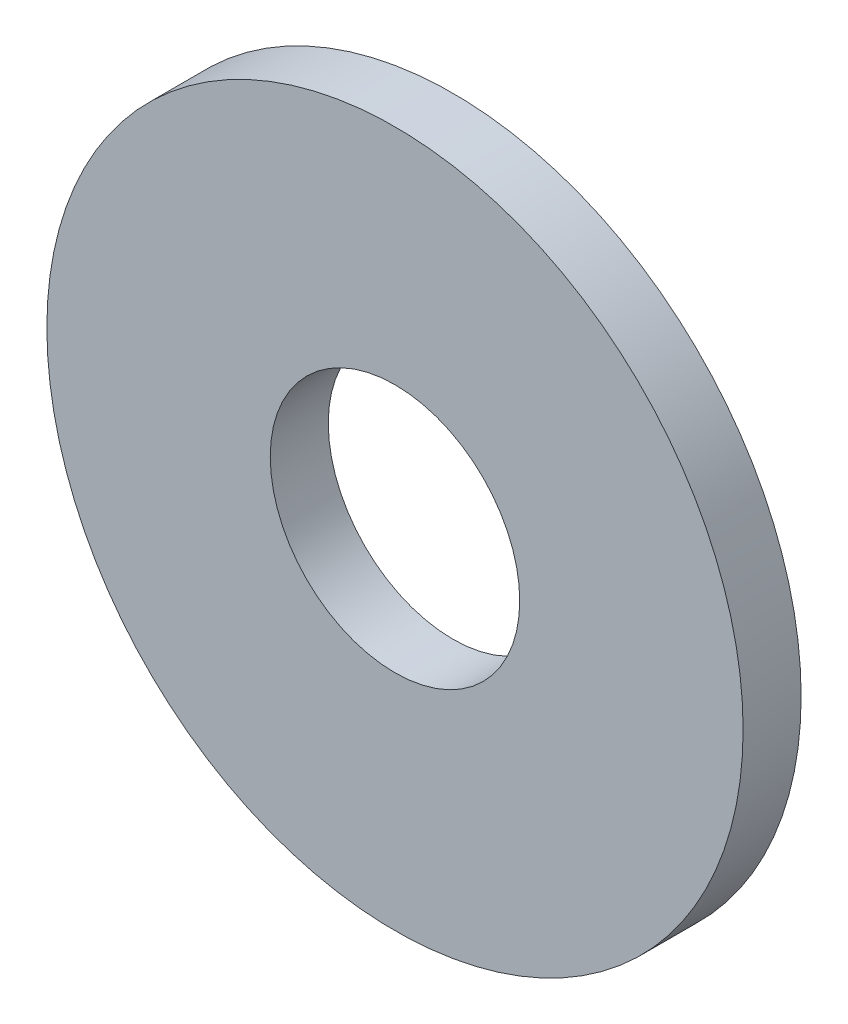
from build123d import *

# Parameters (mm, degrees)
SKETCH1_R           = 6
SKETCH1_R_2         = 2.15
BOSS_EXTRUDE1_DEPTH = 1


with BuildPart() as part:
    # Sketch1 → Boss-Extrude1 (new body)
    with BuildSketch(Plane.XY):
        Circle(SKETCH1_R)
        Circle(SKETCH1_R_2, mode=Mode.SUBTRACT)
    extrude(amount=BOSS_EXTRUDE1_DEPTH)


solid = part.part
